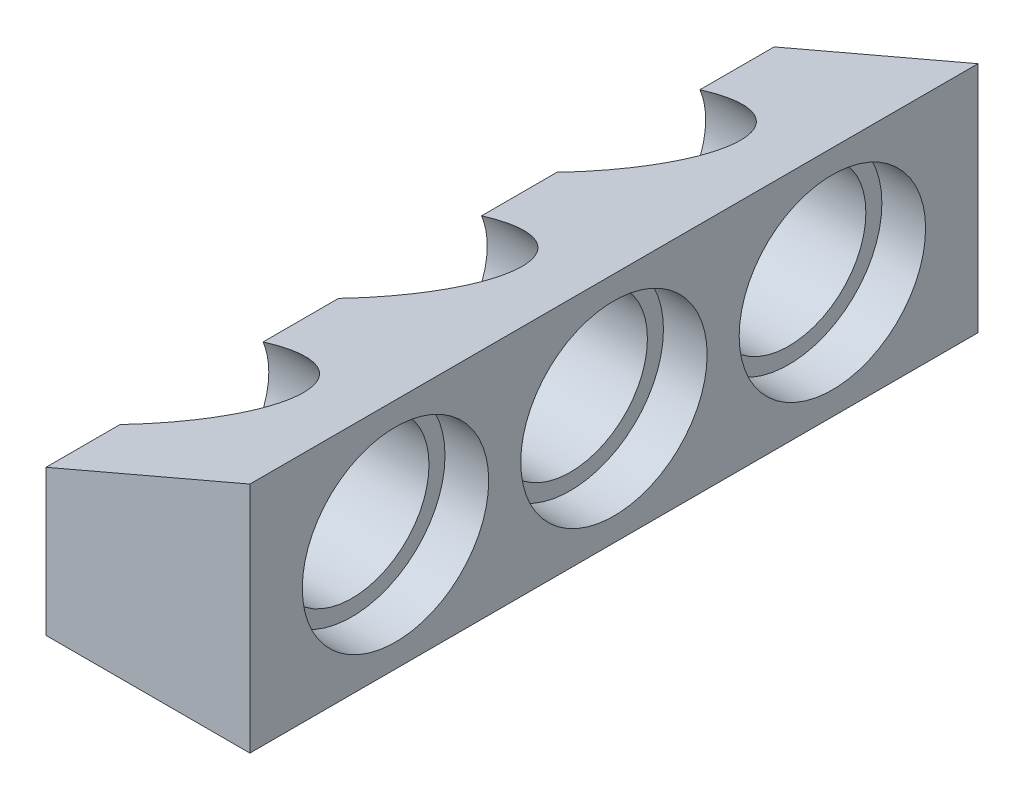
from build123d import *

# Parameters (mm, degrees)
BOSS_EXTRU_1_DEPTH      = 25
ESQUISSE2_R             = 2.65
ENL_V_MAT_EXTRU_1_DEPTH = 28.166155414
ESQUISSE3_R             = 3.2
ENL_V_MAT_EXTRU_2_DEPTH = 1.5


with BuildPart() as part:
    # Esquisse1 → Boss.-Extru.1 (new body)
    with BuildSketch(Plane.XY):
        Polygon((0, 0), (7, 0), (7, 8), (0, 5), align=None)
    extrude(amount=BOSS_EXTRU_1_DEPTH)

    # Esquisse2 → Enlèv. mat.-Extru.1 (cut, through all)
    with BuildSketch(Plane.ZY):
        with Locations(Location((5, 4, 0), (0, 0, 270))):
            Circle(ESQUISSE2_R)
        with Locations(Location((12.5, 4, 0), (0, 0, 270))):
            Circle(ESQUISSE2_R)
        with Locations(Location((20, 4, 0), (0, 0, 270))):
            Circle(ESQUISSE2_R)
    extrude(amount=-ENL_V_MAT_EXTRU_1_DEPTH, mode=Mode.SUBTRACT)

    # Esquisse3 → Enlèv. mat.-Extru.2 (cut)
    with BuildSketch(Plane(origin=(7, 0, 0), x_dir=(0, 0, -1), z_dir=(1, 0, 0))):
        with Locations((-20, 4)):
            Circle(ESQUISSE3_R)
        with Locations((-12.5, 4)):
            Circle(ESQUISSE3_R)
        with Locations((-5, 4)):
            Circle(ESQUISSE3_R)
    extrude(amount=-ENL_V_MAT_EXTRU_2_DEPTH, mode=Mode.SUBTRACT)


solid = part.part
